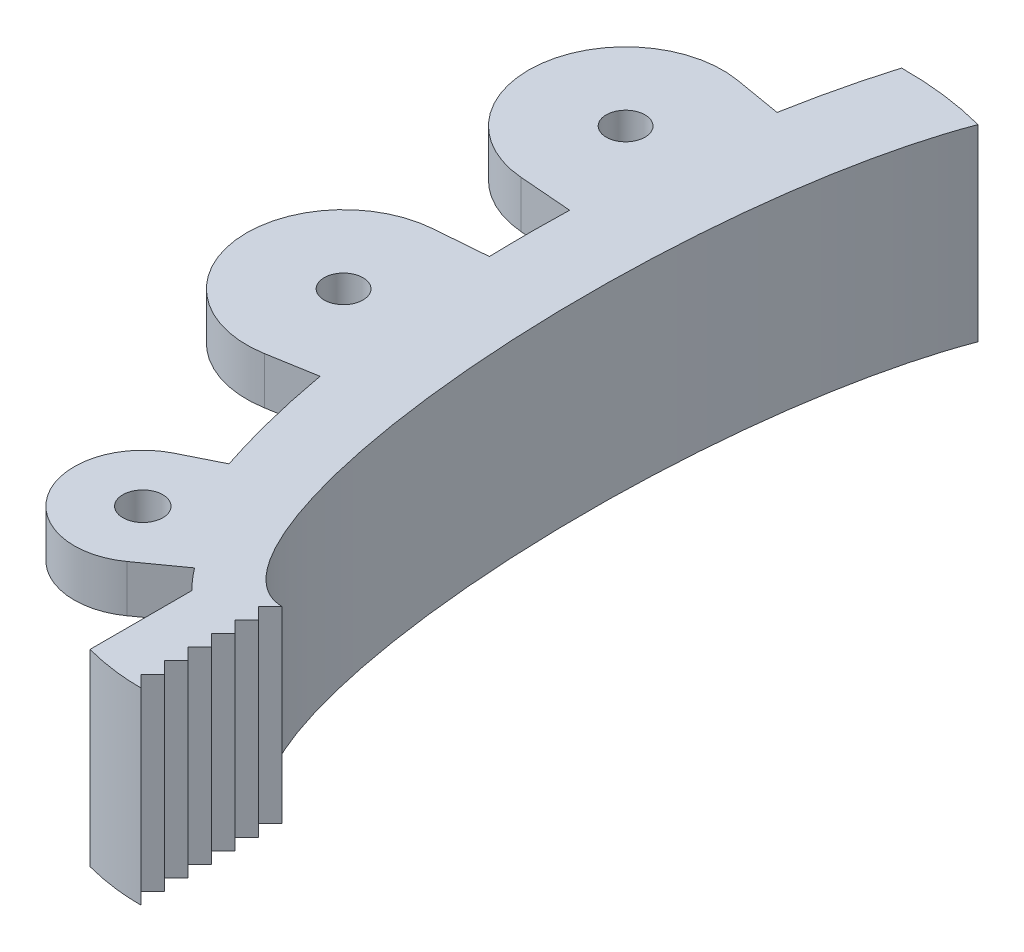
from build123d import *

# Parameters (mm, degrees)
SKETCH_1_R      = 1.7
SKETCH_1_R_2    = 1.65
EXTRUDE_1_DEPTH = 4
EXTRUDE_START   = -16
EXTRUDE_2_DEPTH = 16


with BuildPart() as part:
    # Эскиз1 → Бобышка-Вытянуть1 (new body)
    with BuildSketch(Plane(origin=(0, 0, 0), x_dir=(1, 0, 0), z_dir=(0, 1, 0))):
        with BuildLine():
            Line((-9.899164468, -41.277955038), (-5.860900416, -38.382038285))
            add(Edge.make_bspline(
                [(-9.910314442, 27.829010819), (-20.588879158, -13.776681708), (-5.860900416, -38.382038285)],
                knots=[4.008501268, 4.008501268, 4.008501268, 5.815480813, 5.815480813, 5.815480813], degree=2, weights=[1, 0.618872556, 1]))
            ThreePointArc((-9.910314442, 27.829010819), (-11.606984575, 27.965326889), (-13.308802596, 27.998297108))
            add(Edge.make_bspline(
                [(-13.308802596, 27.998297108), (-14.503698084, 24.018467565), (-15.333061847, 19.433308827)],
                knots=[4.040859142, 4.040859142, 4.040859142, 4.265844637, 4.265844637, 4.265844637], degree=2, weights=[1, 0.993679361, 1]))
            Line((-15.333061847, 19.433308827), (-19.381931407, 20.125663445))
            ThreePointArc((-19.381931407, 20.125663445), (-28.959363457, 13.017768481), (-21.429274281, 3.768599193))
            Line((-21.429274281, 3.768599193), (-16.951090448, 3.411043825))
            add(Edge.make_bspline(
                [(-16.951090448, 3.411043825), (-17.049050673, 0), (-16.951090448, -3.411043825)],
                knots=[4.636515229, 4.636515229, 4.636515229, 4.788262732, 4.788262732, 4.788262732], degree=2, weights=[1, 0.997122968, 1]))
            Line((-16.951090448, -3.411043825), (-21.429274281, -3.768599193))
            ThreePointArc((-21.429274281, -3.768599193), (-28.959363457, -13.017768481), (-19.381931407, -20.125663445))
            Line((-19.381931407, -20.125663445), (-15.333061847, -19.433308827))
            add(Edge.make_bspline(
                [(-15.333061847, -19.433308827), (-14.314023938, -25.067085928), (-12.75383545, -29.753186253)],
                knots=[5.158933324, 5.158933324, 5.158933324, 5.434782065, 5.434782065, 5.434782065], degree=2, weights=[1, 0.990503503, 1]))
            Line((-12.75383545, -29.753186253), (-15.8942706, -31.313606592))
            ThreePointArc((-15.8942706, -31.313606592), (-18.296942807, -39.544856639), (-9.899164468, -41.277955038))
        make_face()
        with Locations(Location((-13.298587158, -36.537567928, 0), (0, 0, 270))):
            Circle(SKETCH_1_R, mode=Mode.SUBTRACT)
        with Locations(Location((-20.772601242, 11.993066919, 0), (0, 0, 270))):
            Circle(SKETCH_1_R_2, mode=Mode.SUBTRACT)
        with Locations(Location((-20.772601242, -11.993066919, 0), (0, 0, 270))):
            Circle(SKETCH_1_R_2, mode=Mode.SUBTRACT)
    extrude(amount=EXTRUDE_1_DEPTH)

    # Эскиз2 → Бобышка-Вытянуть2 (add)
    with BuildSketch(Plane(origin=(0, 4, 0), x_dir=(1, 0, 0), z_dir=(0, 1, 0)).offset(EXTRUDE_START)):
        with BuildLine():
            Line((-5, -49.327554721), (-5, -40.655170705))
            add(Edge.make_bspline(
                [(-10.276192518, 27.867200663), (-28.208103976, -18.227340182), (-5, -40.655170705)],
                knots=[3.896305482, 3.896305482, 3.896305482, 5.943348398, 5.943348398, 5.943348398], degree=2, weights=[1, 0.52036205, 1]))
            ThreePointArc((-10.276192518, 27.867200663), (-8.069315303, 27.562444529), (-5.893652235, 27.083201831))
            add(Edge.make_bspline(
                [(-5.893652235, 27.083201831), (-30.674811567, -38), (0, -38)],
                knots=[3.771865525, 3.771865525, 3.771865525, 6.283185307, 6.283185307, 6.283185307], degree=2, weights=[1, 0.309946191, 1]))
            Line((0, -38), (-1, -39))
            Line((-1, -39), (0, -40))
            Line((0, -40), (-1, -41))
            Line((-1, -41), (0, -42))
            Line((0, -42), (-1, -43))
            Line((-1, -43), (0, -44))
            Line((0, -44), (-1, -45))
            Line((-1, -45), (0, -46))
            Line((0, -46), (-1, -47))
            Line((-1, -47), (0, -48))
            Line((0, -48), (-1, -49))
            Line((-1, -49), (0, -50))
            add(Edge.make_bspline(
                [(-5, -49.327554721), (-2.517635123, -50), (0, -50)],
                knots=[2.974009186, 2.974009186, 2.974009186, 3.141592654, 3.141592654, 3.141592654], degree=2, weights=[1, 0.996491526, 1]))
        make_face()
    extrude(amount=EXTRUDE_2_DEPTH)


solid = part.part
